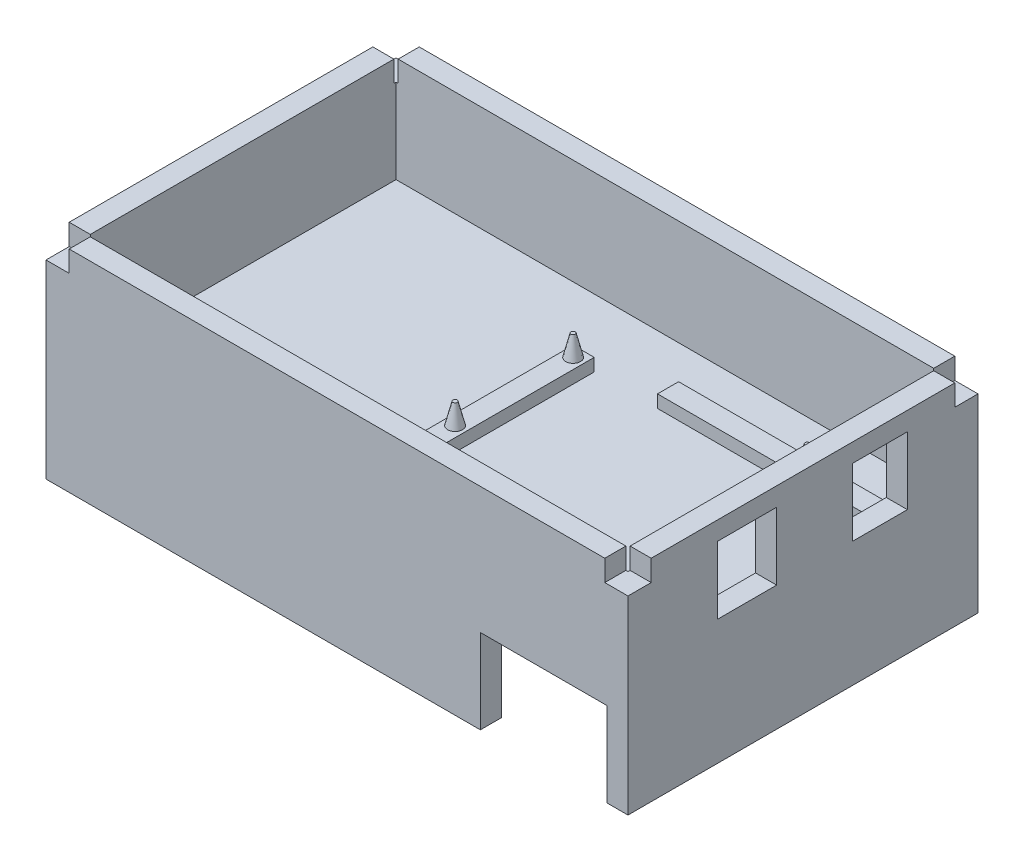
from build123d import *

# Parameters (mm, degrees)
SKETCH1_W                      = 138
SKETCH1_H                      = 83
BOSS_EXTRUDE1_DEPTH            = 5
SKETCH2_W                      = 138
SKETCH2_H                      = 83
SKETCH2_W_2                    = 128
SKETCH2_H_2                    = 73
BOSS_EXTRUDE2_DEPTH            = 20
CUT_EXTRUDE1_REACH             = 108.042
SKETCH3_W                      = 30
SKETCH3_H                      = 20
SKETCH4_W                      = 138
SKETCH4_H                      = 83
SKETCH4_W_2                    = 128
SKETCH4_H_2                    = 73
BOSS_EXTRUDE3_DEPTH            = 25
SKETCH5_W                      = 50
SKETCH5_H                      = 5
SKETCH5_W_2                    = 5
SKETCH5_H_2                    = 35
BOSS_EXTRUDE10_DEPTH           = 3
SKETCH6_R                      = 1.75
BOSS_EXTRUDE11_DEPTH           = 5
BOSS_EXTRUDE11_DRAFT           = 14
BOSS_EXTRUDE11_PROFILE_2_DEPTH = 5
BOSS_EXTRUDE11_PROFILE_2_DRAFT = 14
BOSS_EXTRUDE11_PROFILE_3_DEPTH = 5
BOSS_EXTRUDE11_PROFILE_3_DRAFT = 14
BOSS_EXTRUDE11_PROFILE_4_DEPTH = 5
BOSS_EXTRUDE11_PROFILE_4_DRAFT = 14
CUT_EXTRUDE2_REACH             = 144.518
SKETCH7_W                      = 13
SKETCH7_H                      = 16
CUT_EXTRUDE3_REACH             = 144.518
SKETCH8_W                      = 14
SKETCH8_H                      = 16
SKETCH11_W                     = 5.5
SKETCH11_H                     = 5.5
CUT_EXTRUDE7_DEPTH             = 5


with BuildPart() as part:
    # Sketch1 → Boss-Extrude1 (new body)
    with BuildSketch(Plane(origin=(0, 0, 0), x_dir=(1, 0, 0), z_dir=(0, 1, 0))):
        Rectangle(SKETCH1_W, SKETCH1_H)
    extrude(amount=BOSS_EXTRUDE1_DEPTH)

    # Sketch2 → Boss-Extrude2 (add)
    with BuildSketch(Plane.XZ):
        Rectangle(SKETCH2_W, SKETCH2_H)
        Rectangle(SKETCH2_W_2, SKETCH2_H_2, mode=Mode.SUBTRACT)
    extrude(amount=BOSS_EXTRUDE2_DEPTH)

    # Sketch3 → Cut-Extrude1 (cut, up to next)
    with BuildSketch(Plane(origin=(0, 0, 36.5), x_dir=(-1, 0, 0), z_dir=(0, 0, -1)), mode=Mode.PRIVATE) as cut_extrude1_sk1:
        with Locations((-49, -10)):
            Rectangle(SKETCH3_W, SKETCH3_H)
    cut_extrude1_tool1 = extrude(cut_extrude1_sk1.sketch, amount=-CUT_EXTRUDE1_REACH, mode=Mode.PRIVATE) & part.part
    add(cut_extrude1_tool1.solids().sort_by_distance((49, -10, 36.5))[0], mode=Mode.SUBTRACT)

    # Sketch4 → Boss-Extrude3 (add)
    with BuildSketch(Plane(origin=(0, 5, 0), x_dir=(1, 0, 0), z_dir=(0, 1, 0))):
        Rectangle(SKETCH4_W, SKETCH4_H)
        Rectangle(SKETCH4_W_2, SKETCH4_H_2, mode=Mode.SUBTRACT)
    extrude(amount=BOSS_EXTRUDE3_DEPTH)

    # Sketch5 → Boss-Extrude10 (add)
    with BuildSketch(Plane(origin=(0, 5, 0), x_dir=(1, 0, 0), z_dir=(0, 1, 0))):
        with Locations((39, -26)):
            Rectangle(SKETCH5_W, SKETCH5_H)
        with Locations((39, 23)):
            Rectangle(SKETCH5_W, SKETCH5_H)
        with Locations((-3.5, 3)):
            Rectangle(SKETCH5_W_2, SKETCH5_H_2)
    extrude(amount=BOSS_EXTRUDE10_DEPTH)


with BuildPart() as boss_extrude11_tool:
    # Sketch6 → Boss-Extrude11 (with draft: the straight prism first)
    with BuildSketch(Plane(origin=(0, 8, 0), x_dir=(1, 0, 0), z_dir=(0, 1, 0))):
        with Locations((47, 23)):
            Circle(SKETCH6_R)
    extrude(amount=BOSS_EXTRUDE11_DEPTH)
    # Boss-Extrude11: the draft: its side faces are tilted about the plane it starts from
    boss_extrude11_sides = [boss_extrude11_tool.faces().sort_by_distance(p)[0] for p in [
        (45.25, 10.5, -23),
    ]]
    draft(boss_extrude11_sides, Plane(origin=(0, 8, 0), x_dir=(1, 0, 0), z_dir=(0, 1, 0)), BOSS_EXTRUDE11_DRAFT)


with BuildPart() as part_1:
    add(part.part)

    # Boss-Extrude11: add boss_extrude11_tool
    add(boss_extrude11_tool.part)


with BuildPart() as boss_extrude11_profile_2_tool:
    # Sketch6 → Boss-Extrude11 profile 2 (with draft: the straight prism first)
    with BuildSketch(Plane(origin=(0, 8, 0), x_dir=(1, 0, 0), z_dir=(0, 1, 0))):
        with Locations((47, -26)):
            Circle(SKETCH6_R)
    extrude(amount=BOSS_EXTRUDE11_PROFILE_2_DEPTH)
    # Boss-Extrude11 profile 2: the draft: its side faces are tilted about the plane it starts from
    boss_extrude11_profile_2_sides = [boss_extrude11_profile_2_tool.faces().sort_by_distance(p)[0] for p in [
        (45.25, 10.5, 26),
    ]]
    draft(boss_extrude11_profile_2_sides, Plane(origin=(0, 8, 0), x_dir=(1, 0, 0), z_dir=(0, 1, 0)), BOSS_EXTRUDE11_PROFILE_2_DRAFT)


with BuildPart() as part_2:
    add(part_1.part)

    # Boss-Extrude11 profile 2: add boss_extrude11_profile_2_tool
    add(boss_extrude11_profile_2_tool.part)


with BuildPart() as boss_extrude11_profile_3_tool:
    # Sketch6 → Boss-Extrude11 profile 3 (with draft: the straight prism first)
    with BuildSketch(Plane(origin=(0, 8, 0), x_dir=(1, 0, 0), z_dir=(0, 1, 0))):
        with Locations((-3.5, 18)):
            Circle(SKETCH6_R)
    extrude(amount=BOSS_EXTRUDE11_PROFILE_3_DEPTH)
    # Boss-Extrude11 profile 3: the draft: its side faces are tilted about the plane it starts from
    boss_extrude11_profile_3_sides = [boss_extrude11_profile_3_tool.faces().sort_by_distance(p)[0] for p in [
        (-5.25, 10.5, -18),
    ]]
    draft(boss_extrude11_profile_3_sides, Plane(origin=(0, 8, 0), x_dir=(1, 0, 0), z_dir=(0, 1, 0)), BOSS_EXTRUDE11_PROFILE_3_DRAFT)


with BuildPart() as part_3:
    add(part_2.part)

    # Boss-Extrude11 profile 3: add boss_extrude11_profile_3_tool
    add(boss_extrude11_profile_3_tool.part)


with BuildPart() as boss_extrude11_profile_4_tool:
    # Sketch6 → Boss-Extrude11 profile 4 (with draft: the straight prism first)
    with BuildSketch(Plane(origin=(0, 8, 0), x_dir=(1, 0, 0), z_dir=(0, 1, 0))):
        with Locations((-3.5, -10)):
            Circle(SKETCH6_R)
    extrude(amount=BOSS_EXTRUDE11_PROFILE_4_DEPTH)
    # Boss-Extrude11 profile 4: the draft: its side faces are tilted about the plane it starts from
    boss_extrude11_profile_4_sides = [boss_extrude11_profile_4_tool.faces().sort_by_distance(p)[0] for p in [
        (-5.25, 10.5, 10),
    ]]
    draft(boss_extrude11_profile_4_sides, Plane(origin=(0, 8, 0), x_dir=(1, 0, 0), z_dir=(0, 1, 0)), BOSS_EXTRUDE11_PROFILE_4_DRAFT)


with BuildPart() as part_4:
    add(part_3.part)

    # Boss-Extrude11 profile 4: add boss_extrude11_profile_4_tool
    add(boss_extrude11_profile_4_tool.part)

    # Sketch7 → Cut-Extrude2 (cut, up to next)
    with BuildSketch(Plane.ZY.offset(-64), mode=Mode.PRIVATE) as cut_extrude2_sk1:
        with Locations((-18.25, 17.6)):
            Rectangle(SKETCH7_W, SKETCH7_H)
    cut_extrude2_tool1 = extrude(cut_extrude2_sk1.sketch, amount=-CUT_EXTRUDE2_REACH, mode=Mode.PRIVATE) & part_4.part
    add(cut_extrude2_tool1.solids().sort_by_distance((64, 17.6, -18.25))[0], mode=Mode.SUBTRACT)

    # Sketch8 → Cut-Extrude3 (cut, up to next)
    with BuildSketch(Plane.ZY.offset(-64), mode=Mode.PRIVATE) as cut_extrude3_sk1:
        with Locations((13.25, 17.6)):
            Rectangle(SKETCH8_W, SKETCH8_H)
    cut_extrude3_tool1 = extrude(cut_extrude3_sk1.sketch, amount=-CUT_EXTRUDE3_REACH, mode=Mode.PRIVATE) & part_4.part
    add(cut_extrude3_tool1.solids().sort_by_distance((64, 17.6, 13.25))[0], mode=Mode.SUBTRACT)

    # Sketch11 → Cut-Extrude7 (cut)
    with BuildSketch(Plane(origin=(0, 30, 0), x_dir=(1, 0, 0), z_dir=(0, 1, 0))):
        with Locations((-66.25, 38.75)):
            Rectangle(SKETCH11_W, SKETCH11_H)
        with Locations((-66.25, -38.75)):
            Rectangle(SKETCH11_W, SKETCH11_H)
        with Locations((66.25, -38.75)):
            Rectangle(SKETCH11_W, SKETCH11_H)
        with Locations((66.25, 38.75)):
            Rectangle(SKETCH11_W, SKETCH11_H)
    extrude(amount=-CUT_EXTRUDE7_DEPTH, mode=Mode.SUBTRACT)


solid = part_4.part
